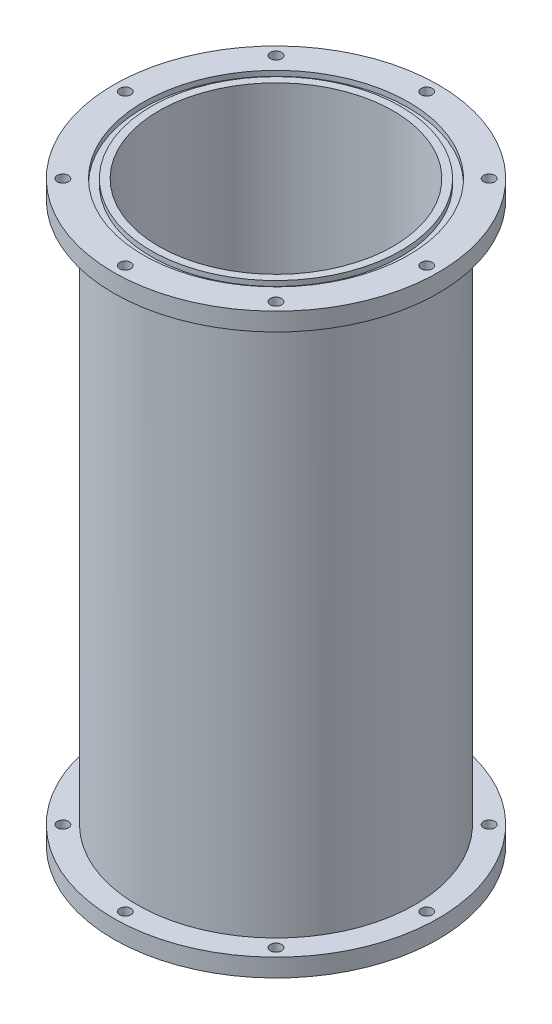
from build123d import *

# Parameters (mm, degrees)
SKETCH3_R           = 38.5
SKETCH3_R_2         = 32.5
BOSS_EXTRUDE3_DEPTH = 160
SKETCH5_R           = 36.7411
SKETCH5_R_2         = 34.6075
CUT_EXTRUDE1_DEPTH  = 1.4224
SKETCH5_4_R         = 45
SKETCH5_4_R_2       = 38.5
BOSS_EXTRUDE5_DEPTH = 5
SKETCH7_R           = 1.55
CUT_EXTRUDE2_DEPTH  = 5
CUT_EXTRUDE3_START  = -80
SKETCH9_R           = 38.5
SKETCH9_R_2         = 32.5
CUT_EXTRUDE3_DEPTH  = 80
CUT_EXTRUDE6_START  = -1.4224
SKETCH5_7_R         = 36.7411
SKETCH5_7_R_2       = 34.6075
CUT_EXTRUDE6_DEPTH  = 1.4224


with BuildPart() as part:
    # Sketch3 → Boss-Extrude3 (new body)
    with BuildSketch(Plane(origin=(0, 0, 0), x_dir=(1, 0, 0), z_dir=(0, 1, 0))):
        Circle(SKETCH3_R)
        Circle(SKETCH3_R_2, mode=Mode.SUBTRACT)
    boss_extrude3 = extrude(amount=BOSS_EXTRUDE3_DEPTH)

    # Sketch5 → Cut-Extrude1 (cut)
    with BuildSketch(Plane.XZ):
        Circle(SKETCH5_R)
        Circle(SKETCH5_R_2, mode=Mode.SUBTRACT)
    cut_extrude1 = extrude(amount=-CUT_EXTRUDE1_DEPTH, mode=Mode.SUBTRACT)

    # Sketch5<4> → Boss-Extrude5 (add)
    with BuildSketch(Plane.XZ):
        Circle(SKETCH5_4_R)
        Circle(SKETCH5_4_R_2, mode=Mode.SUBTRACT)
    boss_extrude5 = extrude(amount=-BOSS_EXTRUDE5_DEPTH)

    # Sketch7 → Cut-Extrude2 (cut)
    with BuildSketch(Plane(origin=(0, 5, 0), x_dir=(1, 0, 0), z_dir=(0, 1, 0))):
        with Locations((0, 41.75)):
            Circle(SKETCH7_R)
        with Locations((29.521708115, 29.521708115)):
            Circle(SKETCH7_R)
        with Locations((41.75, 0)):
            Circle(SKETCH7_R)
        with Locations((29.521708115, -29.521708115)):
            Circle(SKETCH7_R)
        with Locations((0, -41.75)):
            Circle(SKETCH7_R)
        with Locations((-29.521708115, -29.521708115)):
            Circle(SKETCH7_R)
        with Locations((-41.75, 0)):
            Circle(SKETCH7_R)
        with Locations((-29.521708115, 29.521708115)):
            Circle(SKETCH7_R)
    cut_extrude2 = extrude(amount=-CUT_EXTRUDE2_DEPTH, mode=Mode.SUBTRACT)

    # Sketch9 → Cut-Extrude3 (cut)
    with BuildSketch(Plane(origin=(0, 160, 0), x_dir=(1, 0, 0), z_dir=(0, 1, 0)).offset(CUT_EXTRUDE3_START)):
        Circle(SKETCH9_R)
        Circle(SKETCH9_R_2, mode=Mode.SUBTRACT)
    extrude(amount=CUT_EXTRUDE3_DEPTH, mode=Mode.SUBTRACT)

    # Mirror7: Boss-Extrude3, Cut-Extrude1, Boss-Extrude5, Cut-Extrude2 across plane
    add(boss_extrude3.mirror(Plane.ZX.offset(80)))
    add(cut_extrude1.mirror(Plane.ZX.offset(80)), mode=Mode.SUBTRACT)
    add(boss_extrude5.mirror(Plane.ZX.offset(80)))
    add(cut_extrude2.mirror(Plane.ZX.offset(80)), mode=Mode.SUBTRACT)

    # Sketch5<7> → Cut-Extrude6 (cut)
    with BuildSketch(Plane.XZ.offset(CUT_EXTRUDE6_START)):
        Circle(SKETCH5_7_R)
        Circle(SKETCH5_7_R_2, mode=Mode.SUBTRACT)
    extrude(amount=CUT_EXTRUDE6_DEPTH, mode=Mode.SUBTRACT)


solid = part.part
